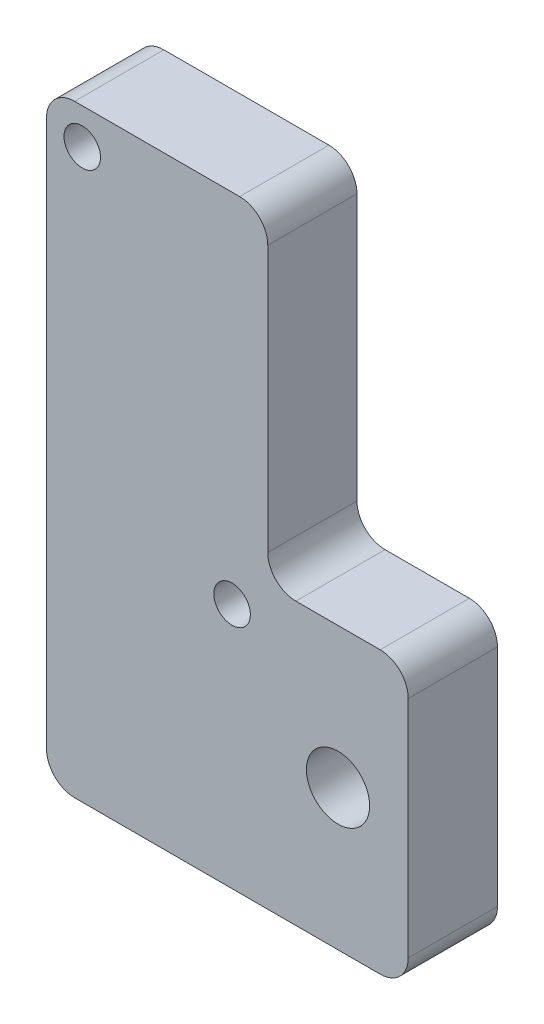
from build123d import *

# Parameters (mm, degrees)
SKETCH1_R           = 2.25
SKETCH1_R_2         = 1.3
BOSS_EXTRUDE1_DEPTH = 6.35
FILLET1_R           = 2


with BuildPart() as part:
    # Sketch1 → Boss-Extrude1 (new body)
    with BuildSketch(Plane.XY):
        Polygon((0, 0), (0, 27.94), (15.748, 27.94), (15.748, 5), (25.748, 5), (25.748, 0), (25.748, -15), (0, -15), align=None)
        with Locations((20.748, -5)):
            Circle(SKETCH1_R, mode=Mode.SUBTRACT)
        with Locations((2.54, 25.4)):
            Circle(SKETCH1_R_2, mode=Mode.SUBTRACT)
        with Locations((13.208, 2.54)):
            Circle(SKETCH1_R_2, mode=Mode.SUBTRACT)
    extrude(amount=BOSS_EXTRUDE1_DEPTH)

    # Fillet1
    fillet1_edges = [part.edges().sort_by_distance(p)[0] for p in [
        (0, 27.94, 3.175),
        (15.748, 27.94, 3.175),
        (15.748, 5, 3.175),
        (25.748, 5, 3.175),
        (25.748, -15, 3.175),
        (0, -15, 3.175),
    ]]
    fillet(fillet1_edges, radius=FILLET1_R)


solid = part.part
